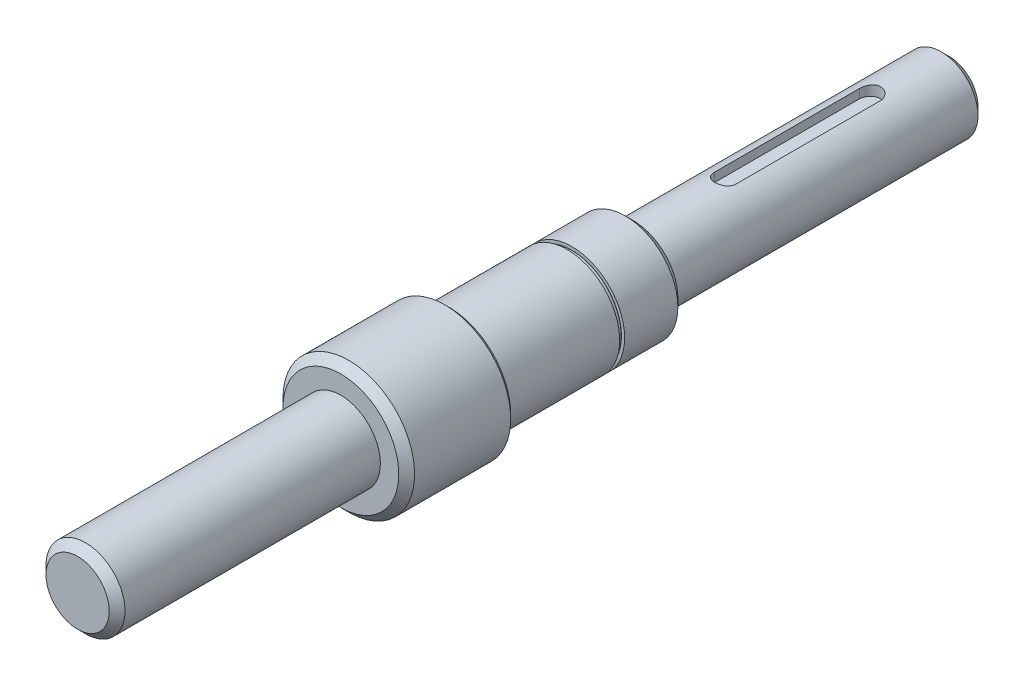
from build123d import *

# Parameters (mm, degrees)
CHAMFER_1_SIZE         = 3
HOLE_WIZARD_M121_D     = 10.2
HOLE_WIZARD_M121_DEPTH = 30
HOLE_WIZARD_M121_TIP   = 3.064389157
SKETCH_4_R             = 20
SKETCH_4_R_2           = 18.75
CUT_EXTRUDE_1_DEPTH    = 1.85
FILLET_1_R             = 0.05
CHAMFER_2_SIZE         = 1.5
CUT_EXTRUDE_2_DEPTH    = 334.782863551
SKETCH_9_R             = 25
SKETCH_9_R_2           = 20
CUT_EXTRUDE_4_DEPTH    = 6
CHAMFER_3_SIZE         = 1.5
CHAMFER_4_SIZE         = 3


with BuildPart() as part:
    # Эскиз1 → Повернуть1 (revolve)
    with BuildSketch(Plane(origin=(0, 0, 0), x_dir=(0, 0, -1), z_dir=(1, 0, 0))):
        Polygon((0, 0), (0, 15), (100, 15), (100, 25), (147, 25), (147, 20), (211, 20), (211, 14), (331, 14), (331, 0), align=None)
    revolve(axis=Axis((0, 0, 0), (0, 0, -1)))

    # Фаска1
    chamfer_1_edges = [part.edges().sort_by_distance(p)[0] for p in [
        (0, -25, -100),
        (0, -15, 0),
        (0, -14, -331),
    ]]
    chamfer(chamfer_1_edges, length=CHAMFER_1_SIZE)

    # Отверстие обработанное метчиком M121
    with Locations(Plane(origin=(0, 0, -331), x_dir=(-1, 0, 0), z_dir=(0, 0, -1))):
        with Locations((0, 0)):
            Hole(HOLE_WIZARD_M121_D / 2, depth=HOLE_WIZARD_M121_DEPTH)
            with Locations((0, 0, -(HOLE_WIZARD_M121_DEPTH + HOLE_WIZARD_M121_TIP / 2))):  # 118° drill point
                Cone(0, HOLE_WIZARD_M121_D / 2, HOLE_WIZARD_M121_TIP, mode=Mode.SUBTRACT)

    # Эскиз4 → Вырез-Вытянуть1 (cut)
    with BuildSketch(Plane(origin=(0, 0, -187.775), x_dir=(-1, 0, 0), z_dir=(0, 0, -1))):
        Circle(SKETCH_4_R)
        Circle(SKETCH_4_R_2, mode=Mode.SUBTRACT)
    extrude(amount=-CUT_EXTRUDE_1_DEPTH, mode=Mode.SUBTRACT)

    # Скругление1
    fillet_1_edges = [part.edges().sort_by_distance(p)[0] for p in [
        (18.75, 0, -185.925),
        (18.75, 0, -187.775),
    ]]
    fillet(fillet_1_edges, radius=FILLET_1_R)

    # Фаска2
    chamfer_2_edges = [part.edges().sort_by_distance(p)[0] for p in [
        (0, -25, -147),
    ]]
    chamfer(chamfer_2_edges, length=CHAMFER_2_SIZE)

    # Эскиз8 → Вырез-Вытянуть2 (cut, through all)
    with BuildSketch(Plane(origin=(0, 10, -331), x_dir=(-1, 0, 0), z_dir=(0, -1, 0))):
        with BuildLine():
            Line((4, -30), (4, -85))
            ThreePointArc((4, -85), (0, -89), (-4, -85))
            Line((-4, -85), (-4, -30))
            ThreePointArc((-4, -30), (0, -26), (4, -30))
        make_face()
    extrude(amount=-CUT_EXTRUDE_2_DEPTH, mode=Mode.SUBTRACT)

    # Эскиз9 → Вырез-Вытянуть4 (cut)
    with BuildSketch(Plane(origin=(0, 0, -147), x_dir=(-1, 0, 0), z_dir=(0, 0, -1))):
        Circle(SKETCH_9_R)
        Circle(SKETCH_9_R_2, mode=Mode.SUBTRACT)
    extrude(amount=-CUT_EXTRUDE_4_DEPTH, mode=Mode.SUBTRACT)

    # Фаска3
    chamfer_3_edges = [part.edges().sort_by_distance(p)[0] for p in [
        (0, -25, -141),
    ]]
    chamfer(chamfer_3_edges, length=CHAMFER_3_SIZE)

    # Фаска4
    chamfer_4_edges = [part.edges().sort_by_distance(p)[0] for p in [
        (0, -20, -211),
    ]]
    chamfer(chamfer_4_edges, length=CHAMFER_4_SIZE)


solid = part.part
